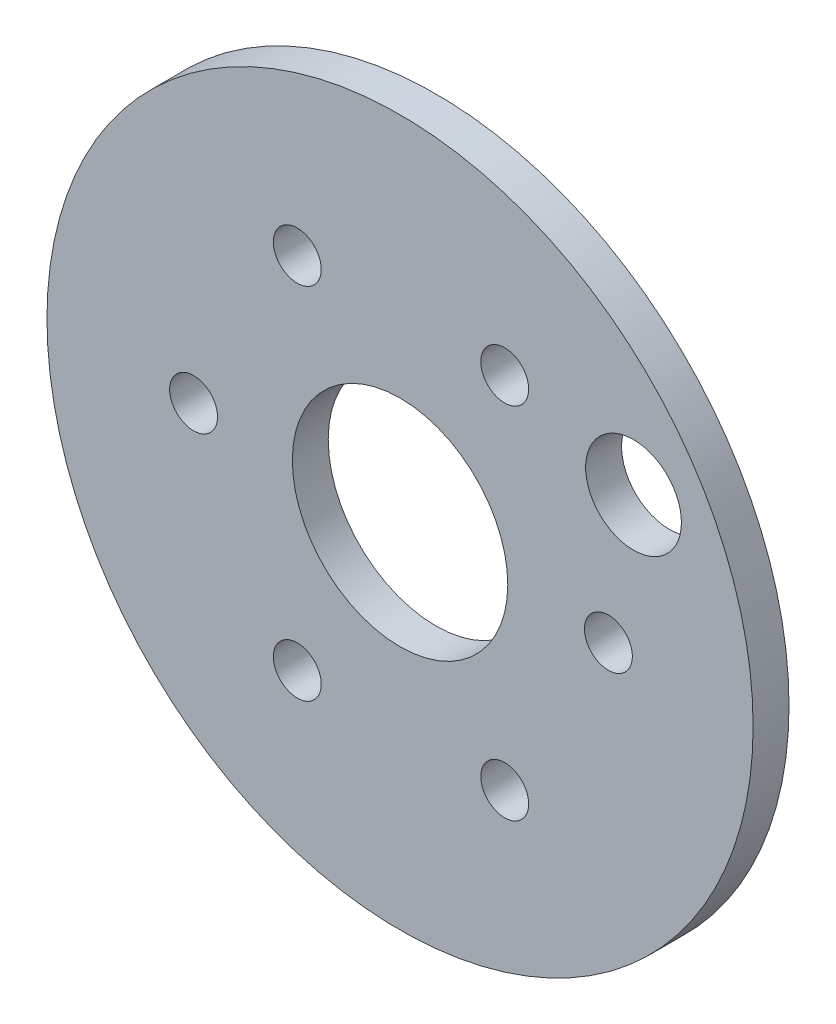
from build123d import *

# Parameters (mm, degrees)
SKETCH_2_R               = 29.5
EXTRUDE_1_DEPTH          = 3
SKETCH_3_R               = 2
CUT_EXTRUDE_1_DEPTH      = 3
PATTERN_CIRCULAR_1_COUNT = 6
SKETCH_4_R               = 9
CUT_EXTRUDE_2_DEPTH      = 3
SKETCH_5_R               = 4
CUT_EXTRUDE_3_DEPTH      = 10


with BuildPart() as part:
    # 草图2 → 凸台-拉伸1 (new body)
    with BuildSketch(Plane.XY):
        Circle(SKETCH_2_R)
    extrude(amount=EXTRUDE_1_DEPTH)

    # 草图3 → 切除-拉伸1 (cut)
    with BuildSketch(Plane.XY.offset(3)):
        with Locations((-17.25, 0)):
            Circle(SKETCH_3_R)
    cut_extrude_1 = extrude(amount=-CUT_EXTRUDE_1_DEPTH, mode=Mode.SUBTRACT)

    # 阵列(圆周)1: 切除-拉伸1 ×6 about axis
    pattern_circular_1_axis = Axis((0.07965368, 0, 0), (0, 0, 1))
    for i in range(1, PATTERN_CIRCULAR_1_COUNT):
        add(cut_extrude_1.rotate(pattern_circular_1_axis, i * 360 / PATTERN_CIRCULAR_1_COUNT), mode=Mode.SUBTRACT)

    # 草图4 → 切除-拉伸2 (cut)
    with BuildSketch(Plane.XY.offset(3)):
        Circle(SKETCH_4_R)
    extrude(amount=-CUT_EXTRUDE_2_DEPTH, mode=Mode.SUBTRACT)

    # 草图5 → 切除-拉伸3 (cut)
    with BuildSketch(Plane.XY.offset(3)):
        with Locations((19.507246774, 11.74145424)):
            Circle(SKETCH_5_R)
    extrude(amount=-CUT_EXTRUDE_3_DEPTH, mode=Mode.SUBTRACT)


solid = part.part
